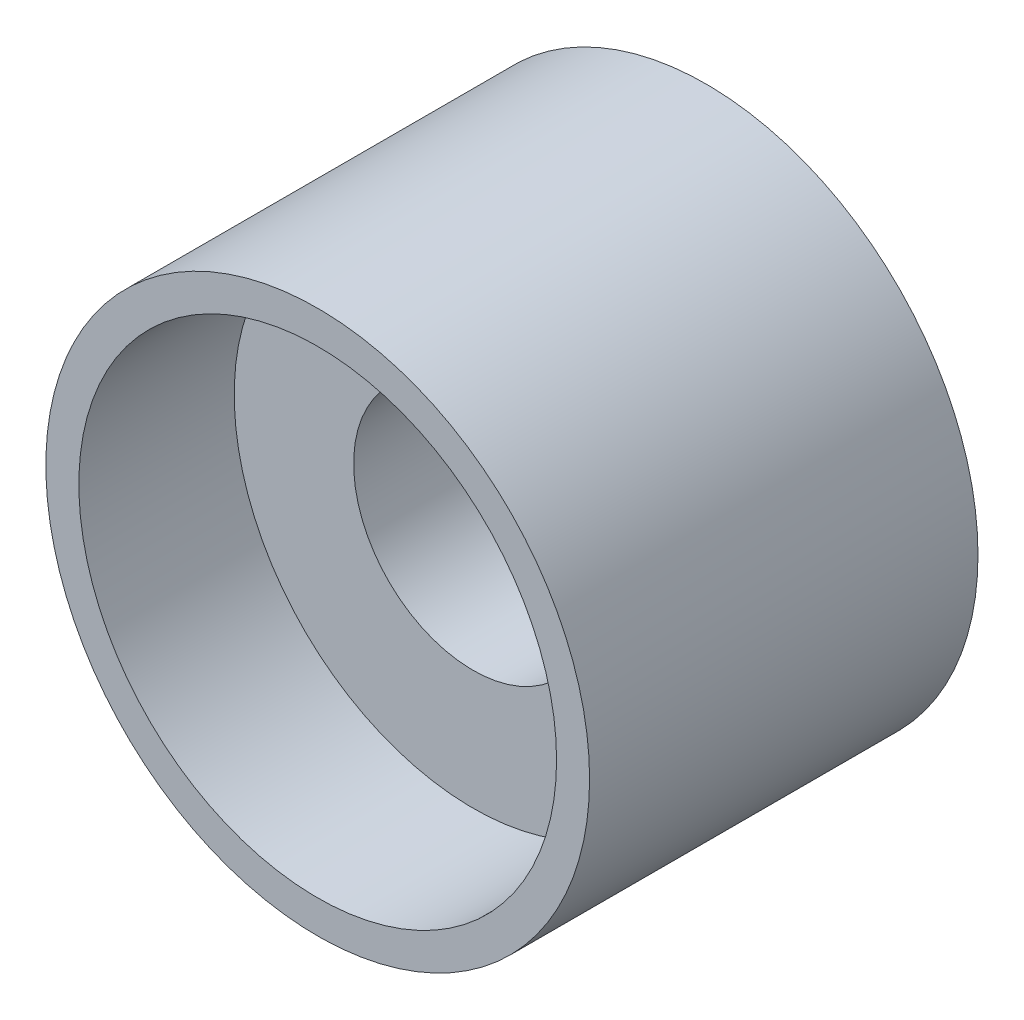
from build123d import *

# Parameters (mm, degrees)
SKETCH1_R           = 14
SKETCH1_R_2         = 6.15
BOSS_EXTRUDE1_DEPTH = 20
SKETCH2_R           = 12.3
CUT_EXTRUDE1_DEPTH  = 8


with BuildPart() as part:
    # Sketch1 → Boss-Extrude1 (new body)
    with BuildSketch(Plane.XY):
        Circle(SKETCH1_R)
        Circle(SKETCH1_R_2, mode=Mode.SUBTRACT)
    extrude(amount=BOSS_EXTRUDE1_DEPTH)

    # Sketch2 → Cut-Extrude1 (cut)
    with BuildSketch(Plane.XY.offset(20)):
        Circle(SKETCH2_R)
    extrude(amount=-CUT_EXTRUDE1_DEPTH, mode=Mode.SUBTRACT)


solid = part.part
